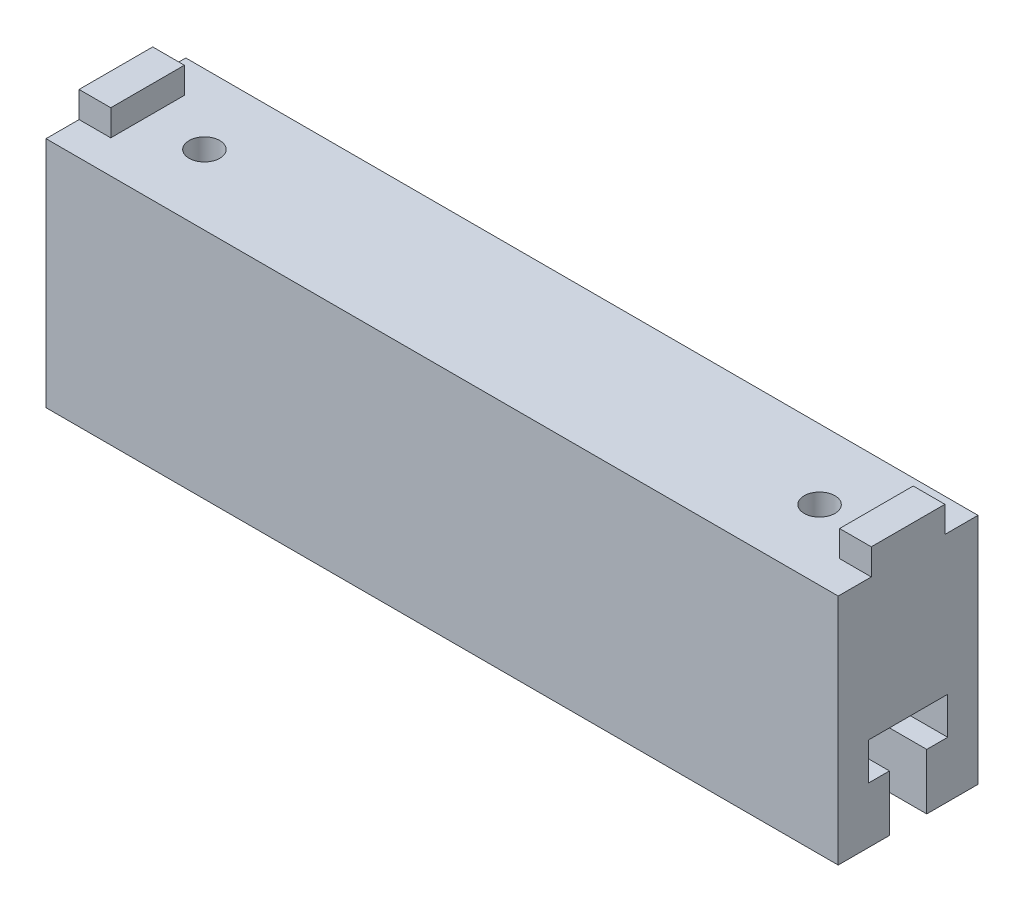
from build123d import *

# Parameters (mm, degrees)
SKETCH1_W               = 85
SKETCH1_H               = 15
BOSS_EXTRUDE1_DEPTH     = 25
SKETCH2_W               = 3.4
SKETCH2_H               = 7.9
BOSS_EXTRUDE2_DEPTH     = 2.8
CUT_EXTRUDE2_DEPTH      = 90.744582009
CUT_EXTRUDE2_DEPTH_BACK = 90.744582009
SKETCH5_R               = 1.651
CUT_EXTRUDE3_DEPTH      = 9.525


with BuildPart() as part:
    # Sketch1 → Boss-Extrude1 (new body)
    with BuildSketch(Plane(origin=(0, 0, 0), x_dir=(1, 0, 0), z_dir=(0, 1, 0))):
        Rectangle(SKETCH1_W, SKETCH1_H)
    extrude(amount=BOSS_EXTRUDE1_DEPTH)

    # Sketch2 → Boss-Extrude2 (add)
    with BuildSketch(Plane(origin=(0, 25, 0), x_dir=(1, 0, 0), z_dir=(0, 1, 0))):
        with Locations((-40.8, 0)):
            Rectangle(SKETCH2_W, SKETCH2_H)
        with Locations((40.8, 0)):
            Rectangle(SKETCH2_W, SKETCH2_H)
    extrude(amount=BOSS_EXTRUDE2_DEPTH)

    # Sketch3 → Cut-Extrude2 (cut, two sides: drawn at the far end of the back side and taken through both)
    with BuildSketch(Plane(origin=(42.5, 0, 0), x_dir=(0, 0, -1), z_dir=(1, 0, 0)).offset(-CUT_EXTRUDE2_DEPTH_BACK)):
        Polygon((-2, 0), (2, 0), (2, 6), (4.25, 6), (4.25, 10), (-4.25, 10), (-4.25, 6), (-2, 6), align=None)
    extrude(amount=CUT_EXTRUDE2_DEPTH + CUT_EXTRUDE2_DEPTH_BACK, mode=Mode.SUBTRACT)

    # Sketch5 → Cut-Extrude3 (cut)
    with BuildSketch(Plane(origin=(0, 25, 0), x_dir=(1, 0, 0), z_dir=(0, 1, 0))):
        with Locations(Location((33, 0, 0), (0, 0, 270))):
            Circle(SKETCH5_R)
        with Locations(Location((-33, 0, 0), (0, 0, 270))):
            Circle(SKETCH5_R)
    extrude(amount=-CUT_EXTRUDE3_DEPTH, mode=Mode.SUBTRACT)


solid = part.part
